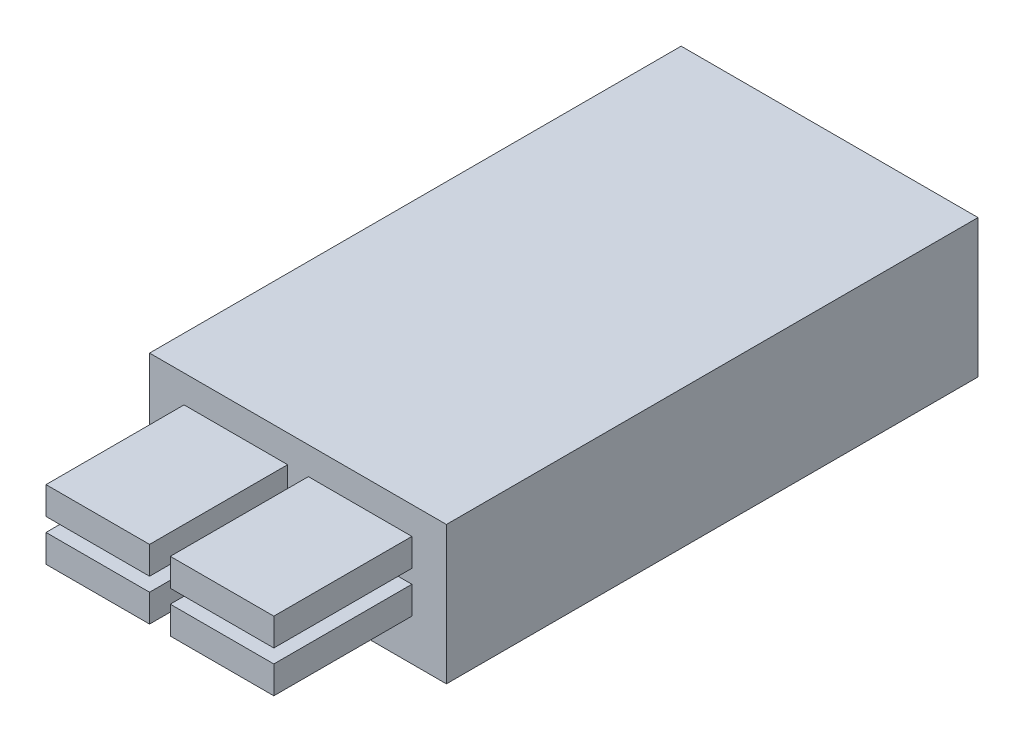
from build123d import *

# Parameters (mm, degrees)
SKETCH1_W           = 21.5
SKETCH1_H           = 38.5
BOSS_EXTRUDE1_DEPTH = 10
SKETCH2_W           = 7.5
SKETCH2_H           = 2
BOSS_EXTRUDE2_DEPTH = 10


with BuildPart() as part:
    # Sketch1 → Boss-Extrude1 (new body)
    with BuildSketch(Plane(origin=(0, 0, 0), x_dir=(1, 0, 0), z_dir=(0, 1, 0))):
        Rectangle(SKETCH1_W, SKETCH1_H)
    extrude(amount=BOSS_EXTRUDE1_DEPTH)

    # Sketch2 → Boss-Extrude2 (add)
    with BuildSketch(Plane.XY.offset(19.25)):
        with Locations((-4.5, 7)):
            Rectangle(SKETCH2_W, SKETCH2_H)
        with Locations((4.5, 4)):
            Rectangle(SKETCH2_W, SKETCH2_H)
        with Locations((-4.5, 4)):
            Rectangle(SKETCH2_W, SKETCH2_H)
        with Locations((4.5, 7)):
            Rectangle(SKETCH2_W, SKETCH2_H)
    extrude(amount=BOSS_EXTRUDE2_DEPTH)


solid = part.part
